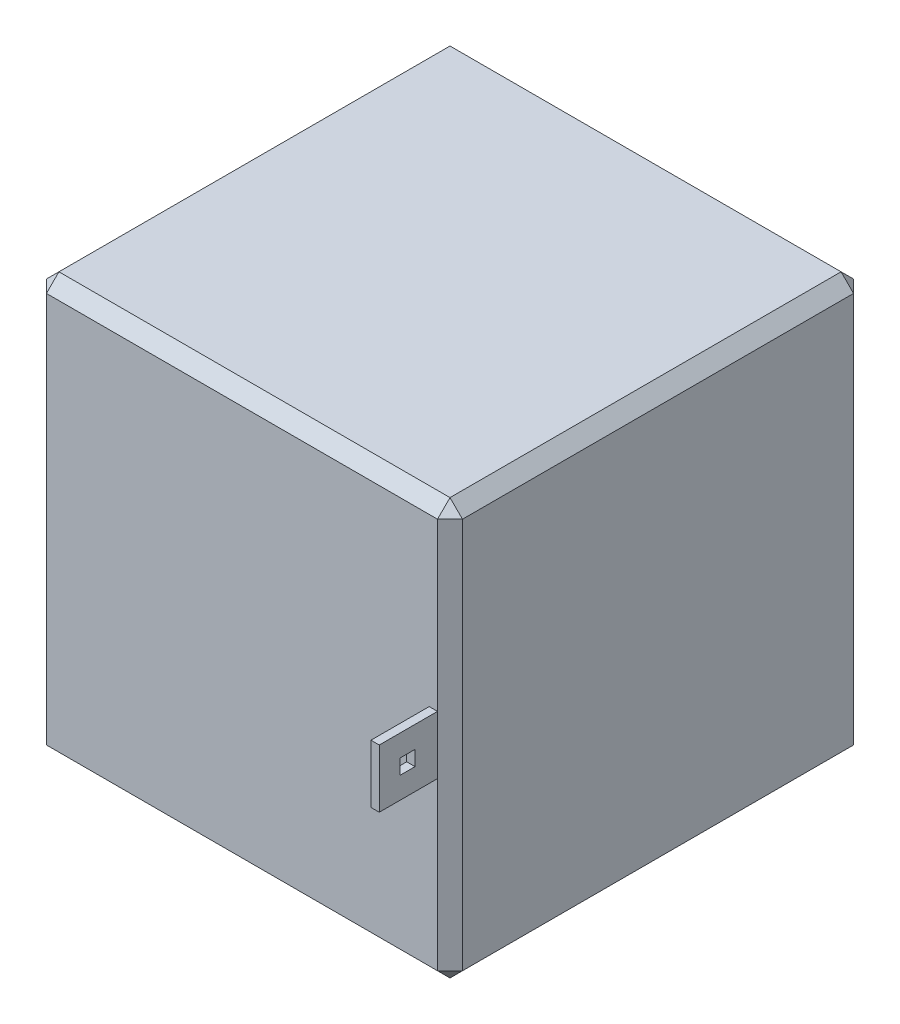
from build123d import *

# Parameters (mm, degrees)
SKETCH1_W           = 50
SKETCH1_H           = 50
BOSS_EXTRUDE1_DEPTH = 50
CHAMFER1_SIZE       = 1.5
SKETCH2_W           = 1
SKETCH2_H           = 7
BOSS_EXTRUDE2_DEPTH = 7
SKETCH3_W           = 1.8
SKETCH3_H           = 1.8
CUT_EXTRUDE1_DEPTH  = 91.006944177


with BuildPart() as part:
    # Sketch1 → Boss-Extrude1 (new body)
    with BuildSketch(Plane.XY):
        with Locations((25, 25)):
            Rectangle(SKETCH1_W, SKETCH1_H)
    extrude(amount=BOSS_EXTRUDE1_DEPTH)

    # Chamfer1
    chamfer1_edges = [part.edges().sort_by_distance(p)[0] for p in [
        (50, 25, 50),
        (25, 50, 50),
        (0, 25, 50),
        (25, 50, 0),
        (50, 25, 0),
        (25, 0, 0),
        (0, 25, 0),
        (25, 0, 50),
        (0, 50, 25),
        (50, 50, 25),
        (50, 0, 25),
        (0, 0, 25),
    ]]
    chamfer(chamfer1_edges, length=CHAMFER1_SIZE)

    # Sketch2 → Boss-Extrude2 (add)
    with BuildSketch(Plane.XY.offset(50)):
        with Locations((48, 25)):
            Rectangle(SKETCH2_W, SKETCH2_H)
    extrude(amount=BOSS_EXTRUDE2_DEPTH)

    # Sketch3 → Cut-Extrude1 (cut, through all)
    with BuildSketch(Plane(origin=(48.5, 0, 0), x_dir=(0, 0, -1), z_dir=(1, 0, 0))):
        with Locations((-53.6, 25)):
            Rectangle(SKETCH3_W, SKETCH3_H)
    extrude(amount=-CUT_EXTRUDE1_DEPTH, mode=Mode.SUBTRACT)


solid = part.part
